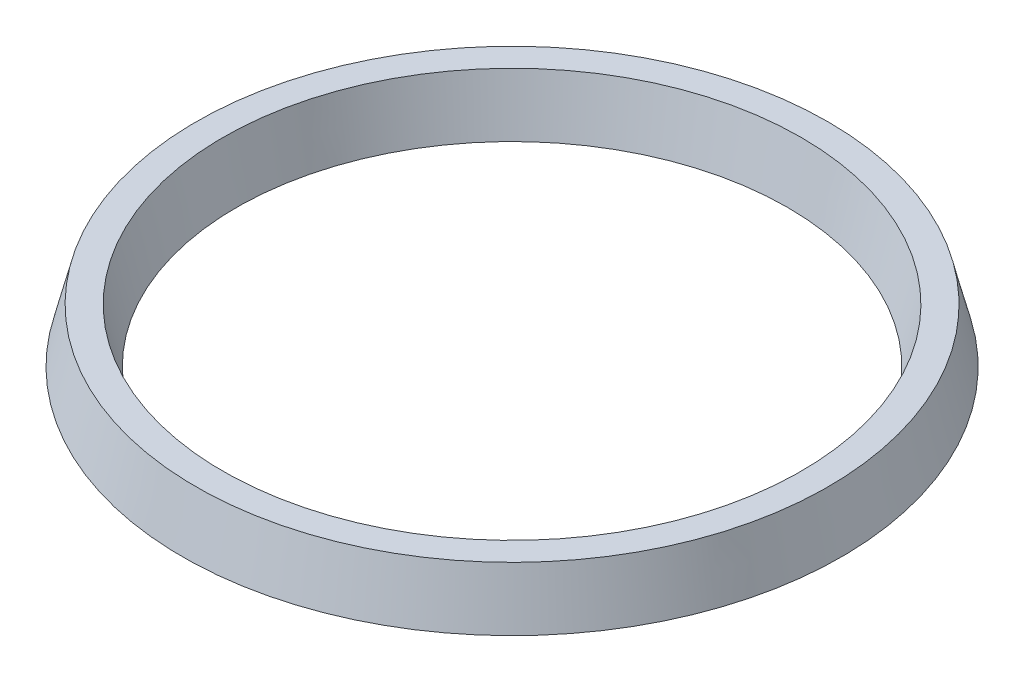
from build123d import *


with BuildPart() as part:
    # Sketch1 → Revolve1 (revolve)
    with BuildSketch(Plane.XY, mode=Mode.PRIVATE) as revolve1_sk:
        with BuildLine():
            Line((-2.401549196, -8.403627102), (-2.164445858, -7.45521375))
            ThreePointArc((-2.164445858, -7.45521375), (-0.30064242, -6), (1.563161017, -7.45521375))
            Line((1.563161017, -7.45521375), (1.817203891, -8.471385244))
            Line((1.817203891, -8.471385244), (2.69935758, -12))
            Line((2.69935758, -12), (5.69935758, -12))
            Line((5.69935758, -12), (2.69935758, 0))
            Line((2.69935758, 0), (-3.30064242, 0))
            Line((-3.30064242, 0), (-6.30064242, -12))
            Line((-6.30064242, -12), (-3.30064242, -12))
            Line((-3.30064242, -12), (-2.401549196, -8.403627102))
        make_face()
    revolve(revolve1_sk.sketch.rotate(Axis((-67.61064242, -6, 0), (0, 1, 0)), 90), axis=Axis((-67.61064242, -6, 0), (0, 1, 0)))


solid = part.part
